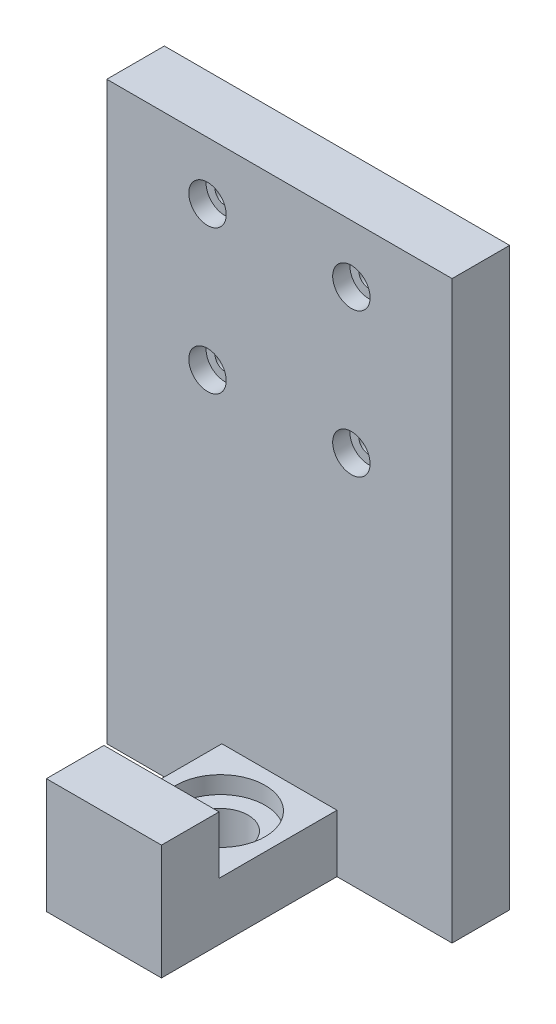
from build123d import *

# Parameters (mm, degrees)
SKETCH1_W                      = 60
SKETCH1_H                      = 100
EXTRUDE1_DEPTH                 = 10
SKETCH2_W                      = 20
SKETCH2_H                      = 10
EXTRUDE2_DEPTH                 = 30.5
SKETCH4_W                      = 20
SKETCH4_H                      = 10
EXTRUDE3_DEPTH                 = 10
SKETCH5_R                      = 7.75
CUT_EXTRUDE1_DEPTH             = 3
SKETCH6_R                      = 4.8
CUT_EXTRUDE2_DEPTH             = 109.769738684
CBORE_FOR_M3_SHCS1_D           = 3.4
CBORE_FOR_M3_SHCS1_CBORE_D     = 6.5
CBORE_FOR_M3_SHCS1_CBORE_DEPTH = 3


with BuildPart() as part:
    # Sketch1 → Extrude1 (new body)
    with BuildSketch(Plane.XY):
        with Locations((-9.263291422, 28.303995668)):
            Rectangle(SKETCH1_W, SKETCH1_H)
    extrude(amount=EXTRUDE1_DEPTH)

    # Sketch2 → Extrude2 (add)
    with BuildSketch(Plane.XY.offset(10)):
        with Locations((-9.263291422, -16.696004332)):
            Rectangle(SKETCH2_W, SKETCH2_H)
    extrude(amount=EXTRUDE2_DEPTH)

    # Sketch4 → Extrude3 (add)
    with BuildSketch(Plane(origin=(0, -11.696004332, 0), x_dir=(1, 0, 0), z_dir=(0, 1, 0))):
        with Locations((-9.263291422, -35.5)):
            Rectangle(SKETCH4_W, SKETCH4_H)
    extrude(amount=EXTRUDE3_DEPTH)

    # Sketch5 → Cut-Extrude1 (cut)
    with BuildSketch(Plane(origin=(0, -11.696004332, 0), x_dir=(1, 0, 0), z_dir=(0, 1, 0))):
        with Locations(Location((-9.263291422, -20.25, 0), (0, 0, 270))):
            Circle(SKETCH5_R)
    extrude(amount=-CUT_EXTRUDE1_DEPTH, mode=Mode.SUBTRACT)

    # Sketch6 → Cut-Extrude2 (cut, through all)
    with BuildSketch(Plane(origin=(0, -14.696004332, 0), x_dir=(1, 0, 0), z_dir=(0, 1, 0))):
        with Locations(Location((-9.263291422, -20.25, 0), (0, 0, 270))):
            Circle(SKETCH6_R)
    extrude(amount=-CUT_EXTRUDE2_DEPTH, mode=Mode.SUBTRACT)

    # CBORE for M3 SHCS1 (through all)
    with Locations(Plane(origin=(-21.763291422, 68.303995668, 10), x_dir=(1, 0, 0), z_dir=(0, 0, 1))):
        with Locations((0, 0), (0, -25), (25, 0), (25, -25)):
            CounterBoreHole(CBORE_FOR_M3_SHCS1_D / 2, CBORE_FOR_M3_SHCS1_CBORE_D / 2, CBORE_FOR_M3_SHCS1_CBORE_DEPTH)


solid = part.part
